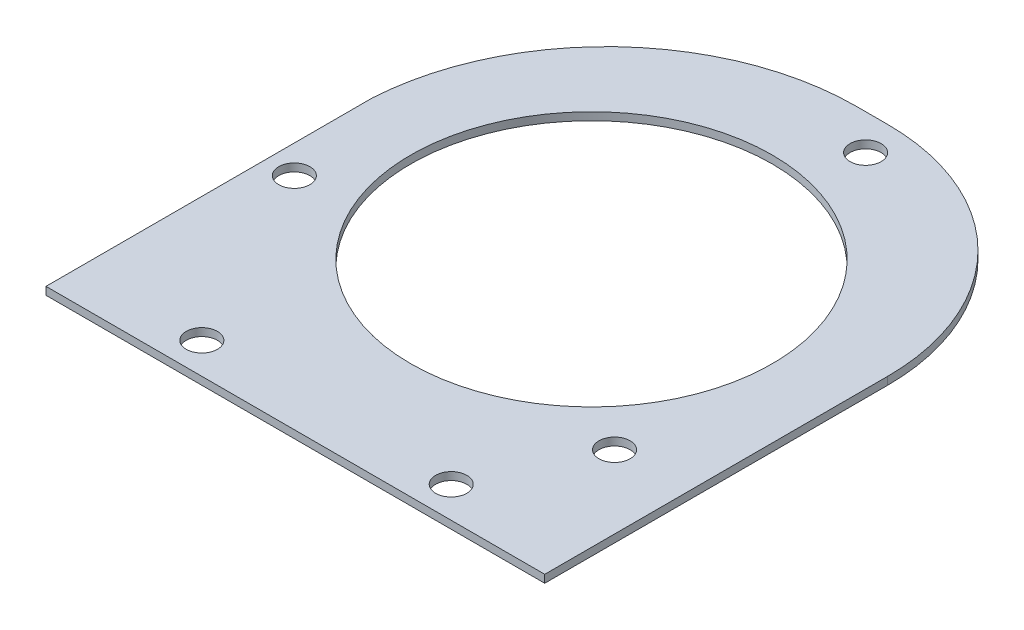
from build123d import *

# Parameters (mm, degrees)
SKETCH1_R           = 73.66
SKETCH1_R_2         = 6.35
BOSS_EXTRUDE1_DEPTH = 3.175


with BuildPart() as part:
    # Sketch1 → Boss-Extrude1 (new body)
    with BuildSketch(Plane(origin=(0, 0, 0), x_dir=(1, 0, 0), z_dir=(0, 1, 0))):
        with BuildLine():
            Line((12.7, 114.3), (0, 114.3))
            ThreePointArc((0, 114.3), (-69.761055355, 86.634356609), (-101.6, 18.676470588))
            Line((-101.6, 18.676470588), (-101.6, -114.3))
            Line((-101.6, -114.3), (101.6, -114.3))
            Line((101.6, -114.3), (101.6, 25.4))
            ThreePointArc((101.6, 25.4), (75.561792847, 88.261792847), (12.7, 114.3))
        make_face()
        with Locations(Location((0, 6.35, 0), (0, 0, 270))):
            Circle(SKETCH1_R, mode=Mode.SUBTRACT)
        with Locations(Location((-90.060644326, -24.660366712, 0), (0, 0, 270))):
            Circle(SKETCH1_R_2, mode=Mode.SUBTRACT)
        with Locations(Location((-50.8, -101.6, 0), (0, 0, 270))):
            Circle(SKETCH1_R_2, mode=Mode.SUBTRACT)
        with Locations(Location((50.8, -101.6, 0), (0, 0, 90))):
            Circle(SKETCH1_R_2, mode=Mode.SUBTRACT)
        with Locations(Location((18.17455681, 99.849989223, 0), (0, 0, 270))):
            Circle(SKETCH1_R_2, mode=Mode.SUBTRACT)
        with Locations(Location((71.886087516, -56.139622511, 0), (0, 0, 270))):
            Circle(SKETCH1_R_2, mode=Mode.SUBTRACT)
    extrude(amount=BOSS_EXTRUDE1_DEPTH)


solid = part.part
